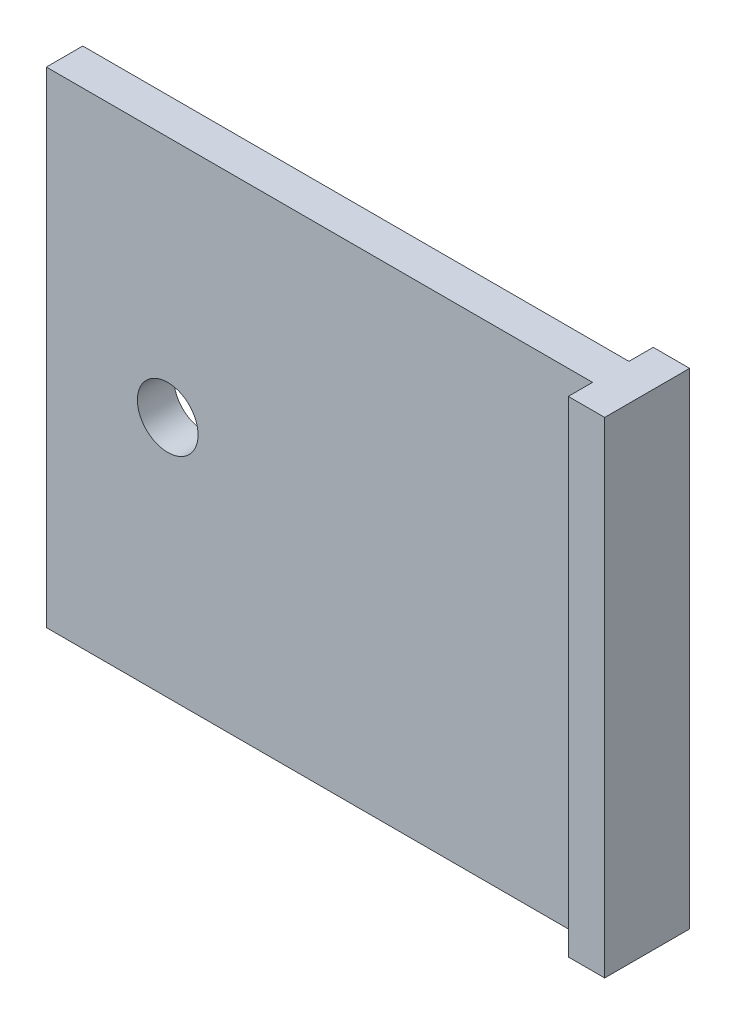
from build123d import *

# Parameters (mm, degrees)
SKETCH_1_W      = 45
SKETCH_1_H      = 40
SKETCH_1_R      = 2.5
EXTRUDE_1_DEPTH = 3
EXTRUDE_START   = 22.5
SKETCH_2_W      = 7
SKETCH_2_H      = 40
EXTRUDE_2_DEPTH = 3


with BuildPart() as part:
    # 草圖1 → 填料-伸長1 (new body)
    with BuildSketch(Plane.XY):
        Rectangle(SKETCH_1_W, SKETCH_1_H)
        with Locations((-12.5, 0)):
            Circle(SKETCH_1_R, mode=Mode.SUBTRACT)
    extrude(amount=EXTRUDE_1_DEPTH)

    # 草圖2 → 填料-伸長2 (add)
    with BuildSketch(Plane(origin=(0, 0, 0), x_dir=(0, 0, -1), z_dir=(1, 0, 0)).offset(EXTRUDE_START)):
        with Locations((-1.5, 0)):
            Rectangle(SKETCH_2_W, SKETCH_2_H)
    extrude(amount=EXTRUDE_2_DEPTH)


solid = part.part
